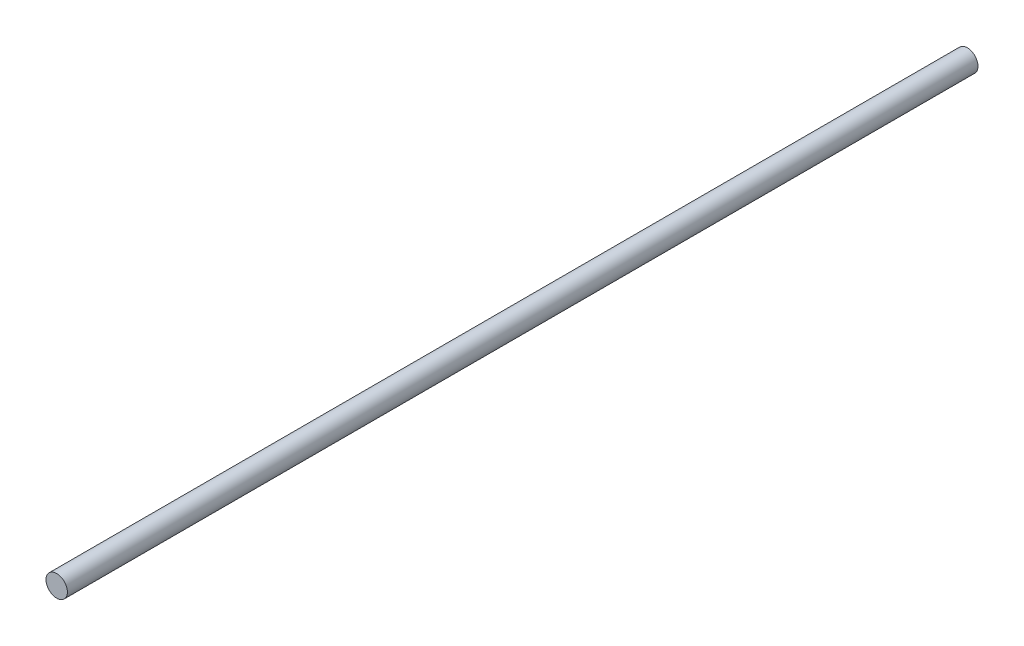
from build123d import *

# Parameters (mm, degrees)
CROQUIS1_R              = 3.175
SALIENTE_EXTRUIR1_DEPTH = 135


with BuildPart() as part:
    # Croquis1 → Saliente-Extruir1 (new, symmetric)
    with BuildSketch(Plane.XY):
        Circle(CROQUIS1_R)
    extrude(amount=SALIENTE_EXTRUIR1_DEPTH, both=True)


solid = part.part
